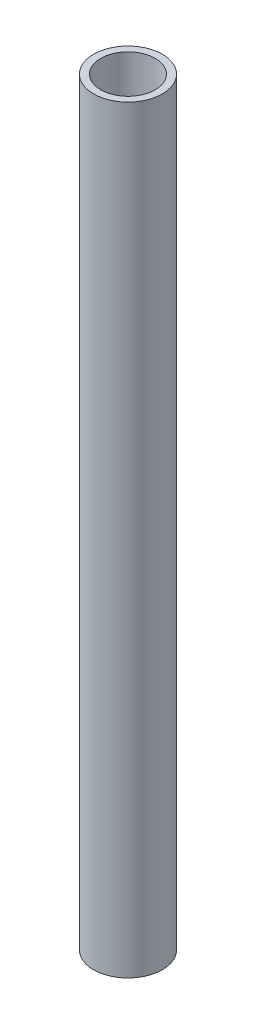
from build123d import *

# Parameters (mm, degrees)
SKETCH1_R           = 14.5
BOSS_EXTRUDE1_DEPTH = 320
SHELL1_T            = -3


with BuildPart() as part:
    # Sketch1 → Boss-Extrude1 (new body)
    with BuildSketch(Plane(origin=(0, 0, 0), x_dir=(1, 0, 0), z_dir=(0, 1, 0))):
        with Locations(Location((0, 0, 0), (0, 0, 270))):
            Circle(SKETCH1_R)
    extrude(amount=BOSS_EXTRUDE1_DEPTH)

    # Shell1
    shell1_openings = [part.faces().sort_by_distance(p)[0] for p in [
        (0, 320, 0),
        (0, 0, 0),
    ]]
    offset(amount=SHELL1_T, openings=shell1_openings, kind=Kind.INTERSECTION)


solid = part.part
